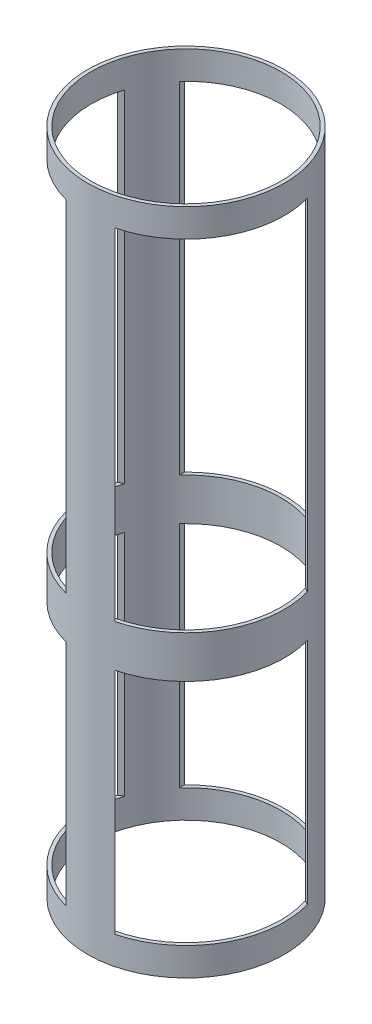
from build123d import *

# Parameters (mm, degrees)
SKETCH1_R               = 88.9
SKETCH1_R_2             = 85.725
BOSS_EXTRUDE1_DEPTH     = 301.625
CUT_EXTRUDE1_REACH      = 328.778
CUT_EXTRUDE1_END_RADIUS = 88.9
SKETCH2_W               = 127
SKETCH2_H               = 206.502
SKETCH2_H_2             = 307.848
CIRPATTERN1_COUNT       = 3


with BuildPart() as part:
    # Sketch1 → Boss-Extrude1 (new, symmetric)
    with BuildSketch(Plane(origin=(0, 0, 0), x_dir=(1, 0, 0), z_dir=(0, 1, 0))):
        with Locations(Location((0, 0, 0), (0, 0, 270))):
            Circle(SKETCH1_R)
        with Locations(Location((0, 0, 0), (0, 0, 270))):
            Circle(SKETCH1_R_2, mode=Mode.SUBTRACT)
    extrude(amount=BOSS_EXTRUDE1_DEPTH, both=True)

    # Cut-Extrude1: up to this cylinder (the profile starts inside it)
    cut_extrude1_end = Plane(origin=(0, -25.3365, 0), z_dir=(0, -1, 0)) * Cylinder(CUT_EXTRUDE1_END_RADIUS, 1131.631, mode=Mode.PRIVATE)
    # Sketch2 → Cut-Extrude1 (cut, up to the surface)
    with BuildSketch(Plane.XY, mode=Mode.PRIVATE) as cut_extrude1_sk1:
        with Locations((0, -172.974)):
            Rectangle(SKETCH2_W, SKETCH2_H)
    cut_extrude1_tool1 = extrude(cut_extrude1_sk1.sketch, amount=-CUT_EXTRUDE1_REACH, mode=Mode.PRIVATE) & cut_extrude1_end
    # Sketch2 → Cut-Extrude1 (cut, up to the surface)
    with BuildSketch(Plane.XY, mode=Mode.PRIVATE) as cut_extrude1_sk2:
        with Locations((0, 122.301)):
            Rectangle(SKETCH2_W, SKETCH2_H_2)
    cut_extrude1_tool2 = extrude(cut_extrude1_sk2.sketch, amount=-CUT_EXTRUDE1_REACH, mode=Mode.PRIVATE) & cut_extrude1_end
    cut_extrude1 = cut_extrude1_tool1.solids().sort_by_distance((0, -172.974, 0))[0] + cut_extrude1_tool2.solids().sort_by_distance((0, 122.301, 0))[0]
    add(cut_extrude1, mode=Mode.SUBTRACT)

    # CirPattern1: Cut-Extrude1 ×3 about axis
    cirpattern1_axis = Axis((0, 0, 0), (0, 1, 0))
    for i in range(1, CIRPATTERN1_COUNT):
        add(cut_extrude1.rotate(cirpattern1_axis, i * 360 / CIRPATTERN1_COUNT), mode=Mode.SUBTRACT)


solid = part.part
